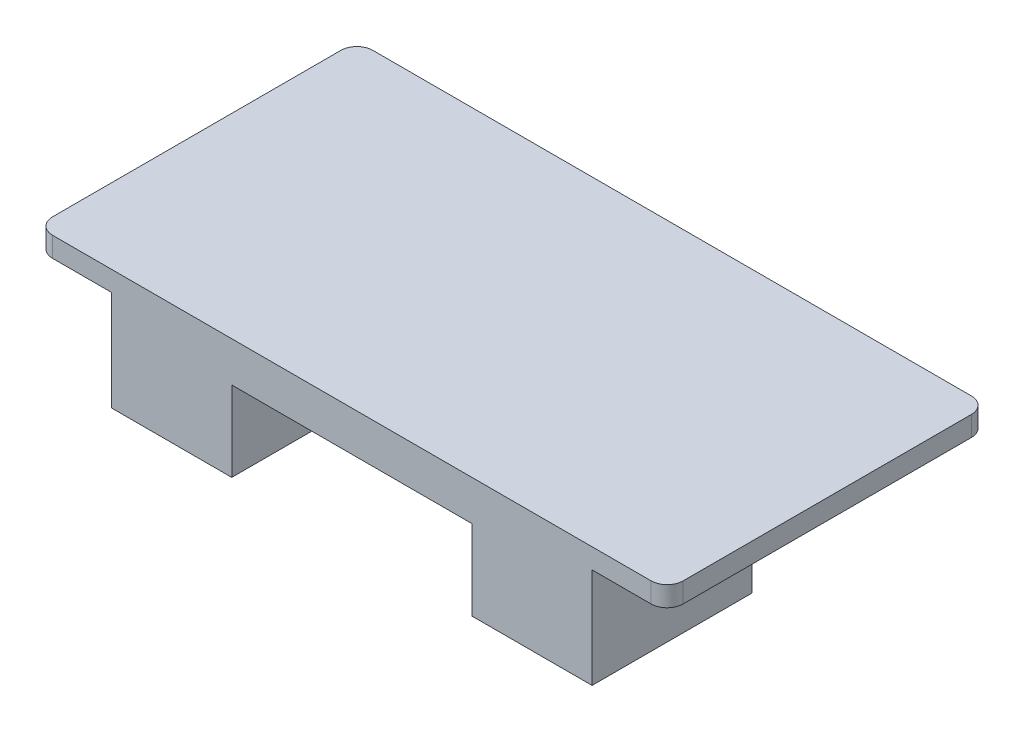
from build123d import *

# Parameters (mm, degrees)
SKETCH_1_W          = 120
SKETCH_1_H          = 40
EXTRUDE_1_DEPTH     = 25
SKETCH_2_R          = 2.75
CUT_EXTRUDE_1_DEPTH = 25
SKETCH_5_W          = 157.5
SKETCH_5_H          = 80
EXTRUDE_2_DEPTH     = 5
SKETCH_6_W          = 60
SKETCH_6_H          = 40
CUT_EXTRUDE_3_DEPTH = 20
FILLET_1_R          = 4
CHAMFER_1_SIZE      = 0.5


with BuildPart() as part:
    # 草图1 → 凸台-拉伸1 (new body)
    with BuildSketch(Plane(origin=(0, 0, 0), x_dir=(1, 0, 0), z_dir=(0, 1, 0))):
        Rectangle(SKETCH_1_W, SKETCH_1_H)
    extrude(amount=EXTRUDE_1_DEPTH)

    # 草图2 → 切除-拉伸1 (cut)
    with BuildSketch(Plane.XZ):
        with Locations(Location((-52.5, 11.75, 0), (0, 0, 270))):
            Circle(SKETCH_2_R)
        with Locations(Location((-52.5, -11.75, 0), (0, 0, 270))):
            Circle(SKETCH_2_R)
        with Locations(Location((52.5, -11.75, 0), (0, 0, 270))):
            Circle(SKETCH_2_R)
        with Locations(Location((52.5, 11.75, 0), (0, 0, 270))):
            Circle(SKETCH_2_R)
    extrude(amount=-CUT_EXTRUDE_1_DEPTH, mode=Mode.SUBTRACT)

    # 草图5 → 凸台-拉伸2 (add)
    with BuildSketch(Plane(origin=(0, 25, 0), x_dir=(1, 0, 0), z_dir=(0, 1, 0))):
        with Locations((0, 20)):
            Rectangle(SKETCH_5_W, SKETCH_5_H)
    extrude(amount=EXTRUDE_2_DEPTH)

    # 草图6 → 切除-拉伸3 (cut)
    with BuildSketch(Plane.XZ):
        Rectangle(SKETCH_6_W, SKETCH_6_H)
    extrude(amount=-CUT_EXTRUDE_3_DEPTH, mode=Mode.SUBTRACT)

    # 圆角1
    fillet_1_edges = [part.edges().sort_by_distance(p)[0] for p in [
        (-78.75, 27.5, -60),
        (-78.75, 27.5, 20),
        (78.75, 27.5, 20),
        (78.75, 27.5, -60),
    ]]
    fillet(fillet_1_edges, radius=FILLET_1_R)

    # 倒角1
    chamfer_1_edges = [part.edges().sort_by_distance(p)[0] for p in [
        (52.5, 0, 14.5),
        (52.5, 0, -9),
        (-52.5, 0, -9),
        (-52.5, 0, 14.5),
    ]]
    chamfer(chamfer_1_edges, length=CHAMFER_1_SIZE)


solid = part.part
